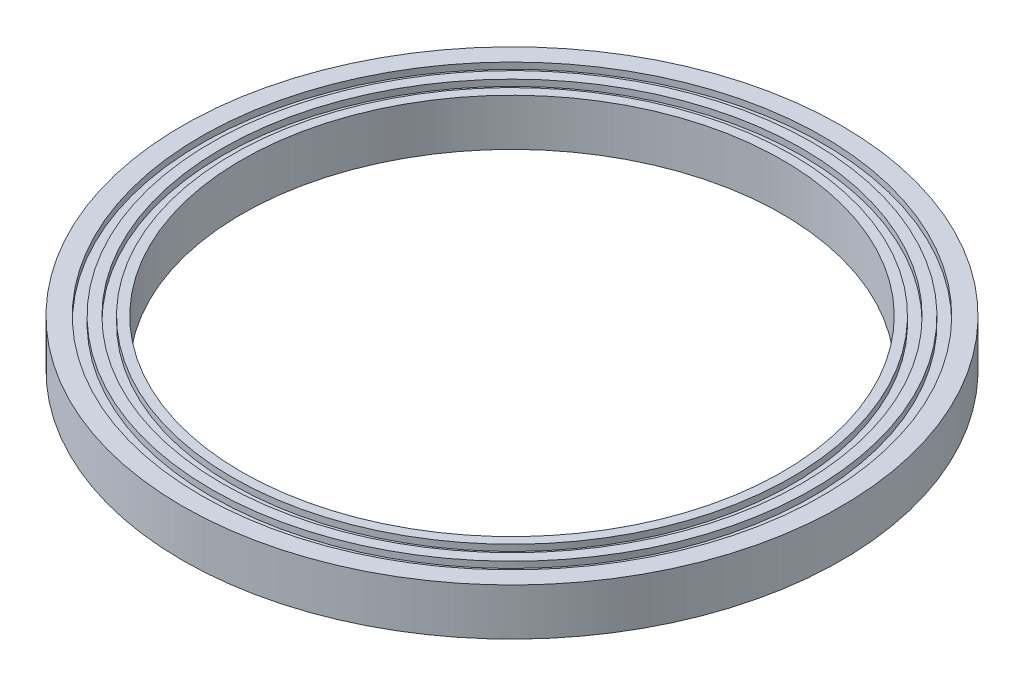
from build123d import *

# Parameters (mm, degrees)
SKETCH1_R           = 9945
SKETCH1_R_2         = 8945
BOSS_EXTRUDE1_DEPTH = 600
SKETCH2_R           = 10540
SKETCH2_R_2         = 8945
BOSS_EXTRUDE2_DEPTH = 1500
SKETCH3_R           = 9945
SKETCH3_R_2         = 8945
CUT_EXTRUDE1_DEPTH  = 500
SKETCH4_R           = 8945
SKETCH4_R_2         = 8645
BOSS_EXTRUDE3_DEPTH = 1500
CUT_EXTRUDE2_START  = -200
SKETCH5_R           = 9275
SKETCH5_R_2         = 8945
CUT_EXTRUDE2_DEPTH  = 200
CUT_EXTRUDE3_START  = -200
SKETCH6_R           = 9945
SKETCH6_R_2         = 9610
CUT_EXTRUDE3_DEPTH  = 200


with BuildPart() as part:
    # Sketch1 → Boss-Extrude1 (new body)
    with BuildSketch(Plane(origin=(0, 0, 0), x_dir=(1, 0, 0), z_dir=(0, 1, 0))):
        with Locations(Location((0, 0, 0), (0, 0, 270))):
            Circle(SKETCH1_R)
        with Locations(Location((0, 0, 0), (0, 0, 270))):
            Circle(SKETCH1_R_2, mode=Mode.SUBTRACT)
    extrude(amount=BOSS_EXTRUDE1_DEPTH)

    # Sketch2 → Boss-Extrude2 (add)
    with BuildSketch(Plane(origin=(0, 0, 0), x_dir=(1, 0, 0), z_dir=(0, 1, 0))):
        with Locations(Location((0, 0, 0), (0, 0, 270))):
            Circle(SKETCH2_R)
        with Locations(Location((0, 0, 0), (0, 0, 270))):
            Circle(SKETCH2_R_2, mode=Mode.SUBTRACT)
    extrude(amount=BOSS_EXTRUDE2_DEPTH)

    # Sketch3 → Cut-Extrude1 (cut)
    with BuildSketch(Plane.XZ):
        with Locations(Location((0, 0, 0), (0, 0, 270))):
            Circle(SKETCH3_R)
        with Locations(Location((0, 0, 0), (0, 0, 270))):
            Circle(SKETCH3_R_2, mode=Mode.SUBTRACT)
    extrude(amount=-CUT_EXTRUDE1_DEPTH, mode=Mode.SUBTRACT)

    # Sketch4 → Boss-Extrude3 (add)
    with BuildSketch(Plane(origin=(0, 0, 0), x_dir=(1, 0, 0), z_dir=(0, 1, 0))):
        with Locations(Location((0, 0, 0), (0, 0, 90))):
            Circle(SKETCH4_R)
        with Locations(Location((0, 0, 0), (0, 0, 270))):
            Circle(SKETCH4_R_2, mode=Mode.SUBTRACT)
    extrude(amount=BOSS_EXTRUDE3_DEPTH)

    # Sketch5 → Cut-Extrude2 (cut)
    with BuildSketch(Plane(origin=(0, 1500, 0), x_dir=(1, 0, 0), z_dir=(0, 1, 0)).offset(CUT_EXTRUDE2_START)):
        with Locations(Location((0, 0, 0), (0, 0, 270))):
            Circle(SKETCH5_R)
        with Locations(Location((0, 0, 0), (0, 0, 90))):
            Circle(SKETCH5_R_2, mode=Mode.SUBTRACT)
    extrude(amount=CUT_EXTRUDE2_DEPTH, mode=Mode.SUBTRACT)

    # Sketch6 → Cut-Extrude3 (cut)
    with BuildSketch(Plane(origin=(0, 1500, 0), x_dir=(1, 0, 0), z_dir=(0, 1, 0)).offset(CUT_EXTRUDE3_START)):
        with Locations(Location((0, 0, 0), (0, 0, 90))):
            Circle(SKETCH6_R)
        with Locations(Location((0, 0, 0), (0, 0, 270))):
            Circle(SKETCH6_R_2, mode=Mode.SUBTRACT)
    extrude(amount=CUT_EXTRUDE3_DEPTH, mode=Mode.SUBTRACT)


solid = part.part
